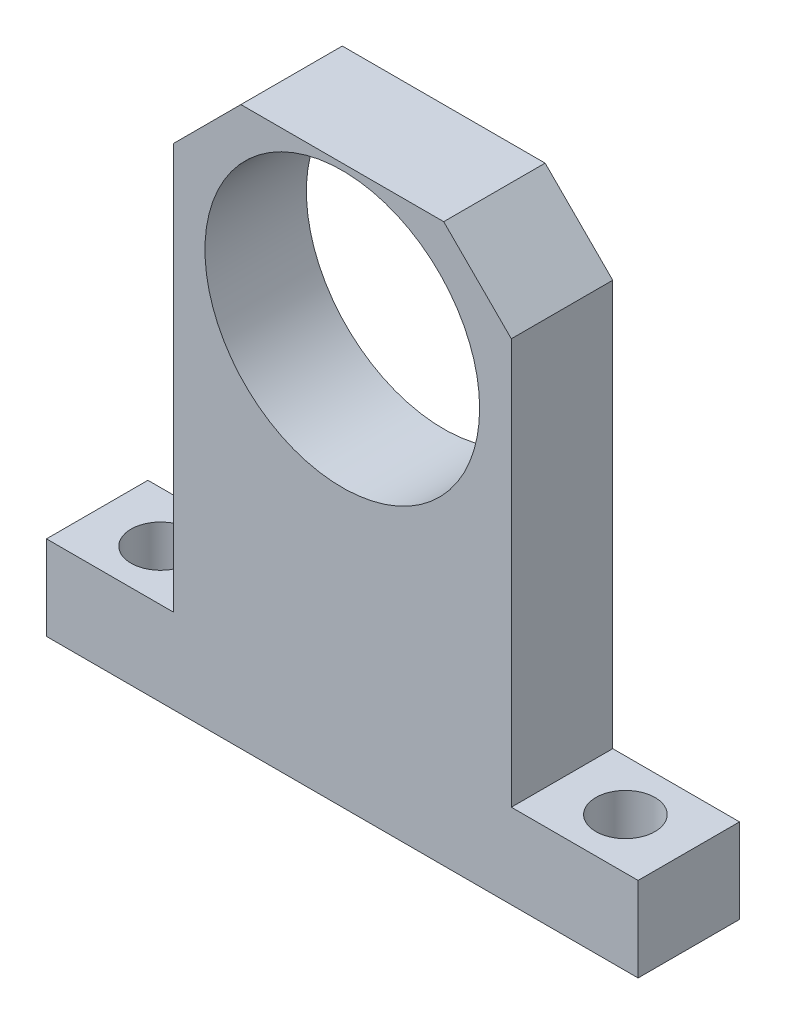
from build123d import *

# Parameters (mm, degrees)
SKETCH_1_R          = 16.25
EXTRUDE_1_DEPTH     = 12
SKETCH_2_R          = 3.5
CUT_EXTRUDE_2_DEPTH = 80.404030124
SKETCH_3_R          = 3.5
CUT_EXTRUDE_3_DEPTH = 80.404030124
CHAMFER_1_SIZE      = 8
CHAMFER_2_SIZE      = 8


with BuildPart() as part:
    # 草圖1 → 填料-伸長1 (new body)
    with BuildSketch(Plane.XY):
        Polygon((40, 0), (55, 0), (55, -10), (-15, -10), (-15, 0), (0, 0), (0, 56), (40, 56), align=None)
        with Locations((20, 39)):
            Circle(SKETCH_1_R, mode=Mode.SUBTRACT)
    extrude(amount=EXTRUDE_1_DEPTH)

    # 草圖2 → 除料-伸長2 (cut, through all)
    with BuildSketch(Plane(origin=(0, 0, 0), x_dir=(1, 0, 0), z_dir=(0, 1, 0))):
        with Locations(Location((47.5, -6, 0), (0, 0, 270))):
            Circle(SKETCH_2_R)
    extrude(amount=-CUT_EXTRUDE_2_DEPTH, mode=Mode.SUBTRACT)

    # 草圖3 → 除料-伸長3 (cut, through all)
    with BuildSketch(Plane(origin=(0, 0, 0), x_dir=(1, 0, 0), z_dir=(0, 1, 0))):
        with Locations(Location((-7.5, -6, 0), (0, 0, 270))):
            Circle(SKETCH_3_R)
    extrude(amount=-CUT_EXTRUDE_3_DEPTH, mode=Mode.SUBTRACT)

    # 導角1
    chamfer_1_edges = [part.edges().sort_by_distance(p)[0] for p in [
        (0, 56, 6),
    ]]
    chamfer(chamfer_1_edges, length=CHAMFER_1_SIZE)

    # 導角2
    chamfer_2_edges = [part.edges().sort_by_distance(p)[0] for p in [
        (40, 56, 6),
    ]]
    chamfer(chamfer_2_edges, length=CHAMFER_2_SIZE)


solid = part.part
